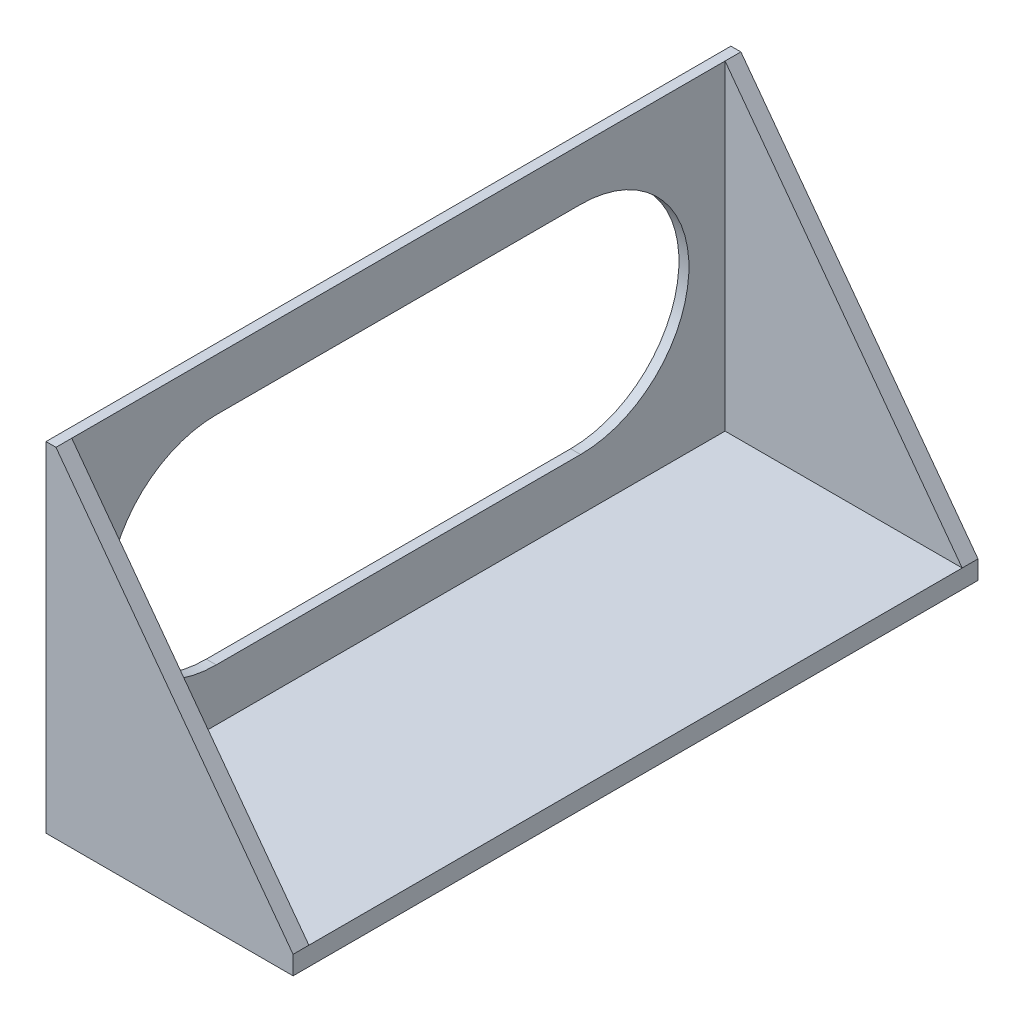
from build123d import *

# Parameters (mm, degrees)
SKETCH2_W                = 311.404
SKETCH2_H                = 311.404
BOSS_EXTRUDE1_DEPTH      = 67.31
SKETCH4_W                = 289.56
SKETCH4_H                = 289.56
CUT_EXTRUDE1_DEPTH       = 25.4
SKETCH5_W                = 273.304
SKETCH5_H                = 273.304
CUT_EXTRUDE2_DEPTH       = 60.96
SKETCH6_W                = 304.8
SKETCH6_H                = 304.8
SKETCH6_W_2              = 298.196
SKETCH6_H_2              = 298.196
CUT_EXTRUDE3_DEPTH       = 12.7
CUT_EXTRUDE4_REACH       = 356.607
CUT_EXTRUDE5_DEPTH       = 17.45
CUT_EXTRUDE6_REACH       = 356.607
SKETCH11_W               = 76.2
SKETCH11_H               = 20.32
CUT_EXTRUDE7_DEPTH       = 17.45
CUT_EXTRUDE8_DEPTH       = 354.20286992
CUT_EXTRUDE8_DEPTH_BACK  = 354.20286992
SKETCH12_OUTSIDE_W       = 402.506
SKETCH12_OUTSIDE_H       = 158.412
SKETCH13_W               = 110.05
SKETCH13_H               = 51.5
SKETCH13_W_2             = 97.35
SKETCH13_H_2             = 38.8
BOSS_EXTRUDE2_DEPTH      = 1.6
BOSS_EXTRUDE3_DEPTH      = 38.1
BOSS_EXTRUDE3_DEPTH_BACK = 1.6
SKETCH15_W               = 110.05
SKETCH15_H               = 3
RIB1_REACH               = 199.5
SKETCH16_WALL_W          = 461.061960636
SKETCH16_WALL_H          = 2.54


with BuildPart() as part:
    # Sketch2 → Boss-Extrude1 (new body)
    with BuildSketch(Plane(origin=(0, 0, 0), x_dir=(1, 0, 0), z_dir=(0, 1, 0))):
        Rectangle(SKETCH2_W, SKETCH2_H)
    extrude(amount=BOSS_EXTRUDE1_DEPTH)

    # Sketch4 → Cut-Extrude1 (cut)
    with BuildSketch(Plane(origin=(0, 67.31, 0), x_dir=(1, 0, 0), z_dir=(0, 1, 0))):
        Rectangle(SKETCH4_W, SKETCH4_H)
    extrude(amount=-CUT_EXTRUDE1_DEPTH, mode=Mode.SUBTRACT)

    # Sketch5 → Cut-Extrude2 (cut)
    with BuildSketch(Plane(origin=(0, 67.31, 0), x_dir=(1, 0, 0), z_dir=(0, 1, 0))):
        Rectangle(SKETCH5_W, SKETCH5_H)
    extrude(amount=-CUT_EXTRUDE2_DEPTH, mode=Mode.SUBTRACT)

    # Sketch6 → Cut-Extrude3 (cut)
    with BuildSketch(Plane(origin=(0, 67.31, 0), x_dir=(1, 0, 0), z_dir=(0, 1, 0))):
        Rectangle(SKETCH6_W, SKETCH6_H)
        Rectangle(SKETCH6_W_2, SKETCH6_H_2, mode=Mode.SUBTRACT)
    extrude(amount=-CUT_EXTRUDE3_DEPTH, mode=Mode.SUBTRACT)

    # Sketch7 → Cut-Extrude4 (cut, up to next)
    with BuildSketch(Plane.ZY.offset(155.702), mode=Mode.PRIVATE) as cut_extrude4_sk1:
        with BuildLine():
            Line((-29.275, 43.15), (29.275, 43.15))
            ThreePointArc((29.275, 43.15), (46.675, 25.75), (29.275, 8.35))
            Line((29.275, 8.35), (-29.275, 8.35))
            ThreePointArc((-29.275, 8.35), (-46.675, 25.75), (-29.275, 43.15))
        make_face()
    cut_extrude4_tool1 = extrude(cut_extrude4_sk1.sketch, amount=-CUT_EXTRUDE4_REACH, mode=Mode.PRIVATE) & part.part
    add(cut_extrude4_tool1.solids().sort_by_distance((-155.702, 25.75, 0))[0], mode=Mode.SUBTRACT)

    # Sketch8 → Cut-Extrude5 (cut)
    with BuildSketch(Plane(origin=(-136.652, 0, 0), x_dir=(0, 0, -1), z_dir=(1, 0, 0))):
        Polygon((29.275, 45.15), (48.675, 45.15), (48.675, 25.75), (48.675, 6.35), (29.275, 6.35), (-29.275, 6.35), (-48.675, 6.35), (-48.675, 25.75), (-48.675, 45.15), (-29.275, 45.15), align=None)
    extrude(amount=-CUT_EXTRUDE5_DEPTH, mode=Mode.SUBTRACT)

    # Sketch9 → Cut-Extrude6 (cut, up to next)
    with BuildSketch(Plane.ZY.offset(155.702), mode=Mode.PRIVATE) as cut_extrude6_sk1:
        with BuildLine():
            Line((46.014100932, 30.5), (48.175, 30.5))
            Line((48.175, 30.5), (48.175, 21))
            Line((48.175, 21), (46.014100932, 21))
            ThreePointArc((46.014100932, 21), (46.675, 25.75), (46.014100932, 30.5))
        make_face()
    cut_extrude6_tool1 = extrude(cut_extrude6_sk1.sketch, amount=-CUT_EXTRUDE6_REACH, mode=Mode.PRIVATE) & part.part
    add(cut_extrude6_tool1.solids().sort_by_distance((-155.702, 25.75, 47.304468))[0], mode=Mode.SUBTRACT)

    # Sketch11 → Cut-Extrude7 (cut)
    with BuildSketch(Plane(origin=(-136.652, 0, 0), x_dir=(0, 0, -1), z_dir=(1, 0, 0))):
        with Locations((-86.775, 25.4)):
            Rectangle(SKETCH11_W, SKETCH11_H)
    extrude(amount=-CUT_EXTRUDE7_DEPTH, mode=Mode.SUBTRACT)

    # Sketch12 outside → Cut-Extrude8 (cut, two sides: drawn at the far end of the back side and taken through both)
    with BuildSketch(Plane(origin=(-154.102, 0, 0), x_dir=(0, 0, -1), z_dir=(1, 0, 0)).offset(-CUT_EXTRUDE8_DEPTH_BACK)):
        with Locations((0, 33.655)):
            Rectangle(SKETCH12_OUTSIDE_W, SKETCH12_OUTSIDE_H)
        Polygon((-48.675, 35.56), (-48.675, 15.24), (-48.675, 6.35), (48.675, 6.35), (48.675, 45.15), (-48.675, 45.15), align=None, mode=Mode.SUBTRACT)
    extrude(amount=CUT_EXTRUDE8_DEPTH + CUT_EXTRUDE8_DEPTH_BACK, mode=Mode.SUBTRACT)


with BuildPart() as cut_extrude8_kept_piece:
    # of the separate pieces the step leaves, the one the design keeps (cut_extrude8_pieces_kept)
    add(part.part.solids().sort_by_distance((-155.702, 6.35, 48.675))[0])

    # Sketch13 → Boss-Extrude2 (add)
    with BuildSketch(Plane(origin=(-154.102, 0, 0), x_dir=(0, 0, -1), z_dir=(1, 0, 0))):
        with Locations((0, 25.75)):
            Rectangle(SKETCH13_W, SKETCH13_H)
        with Locations((0, 25.75)):
            Rectangle(SKETCH13_W_2, SKETCH13_H_2, mode=Mode.SUBTRACT)
    extrude(amount=-BOSS_EXTRUDE2_DEPTH)

    # Sketch15 → Boss-Extrude3 (add, two sides: drawn at the far end of the back side and taken through both)
    with BuildSketch(Plane(origin=(-154.102, 0, 0), x_dir=(0, 0, -1), z_dir=(1, 0, 0)).offset(-BOSS_EXTRUDE3_DEPTH_BACK)):
        with Locations((0, -1.5)):
            Rectangle(SKETCH15_W, SKETCH15_H)
    extrude(amount=BOSS_EXTRUDE3_DEPTH + BOSS_EXTRUDE3_DEPTH_BACK)

    # Sketch16 wall → Rib1 (add, up to next)
    with BuildSketch(Plane(origin=(-135.052, 25.75, 55.025), x_dir=(0.594742134678, -0.803916533751, 0), z_dir=(0.803916533751, 0.594742134678, 0)), mode=Mode.PRIVATE) as rib1_sk1:
        with Locations((0, 1.27)):
            Rectangle(SKETCH16_WALL_W, SKETCH16_WALL_H)
    rib1_tool1 = extrude(rib1_sk1.sketch, amount=-RIB1_REACH, mode=Mode.PRIVATE) - cut_extrude8_kept_piece.part
    rib1 = rib1_tool1.solids().sort_by_distance((-135.052, 25.75, 55.025))[0]
    add(rib1)

    # Mirror1: Rib1 across plane
    add(rib1.mirror(Plane.XY))


solid = cut_extrude8_kept_piece.part
